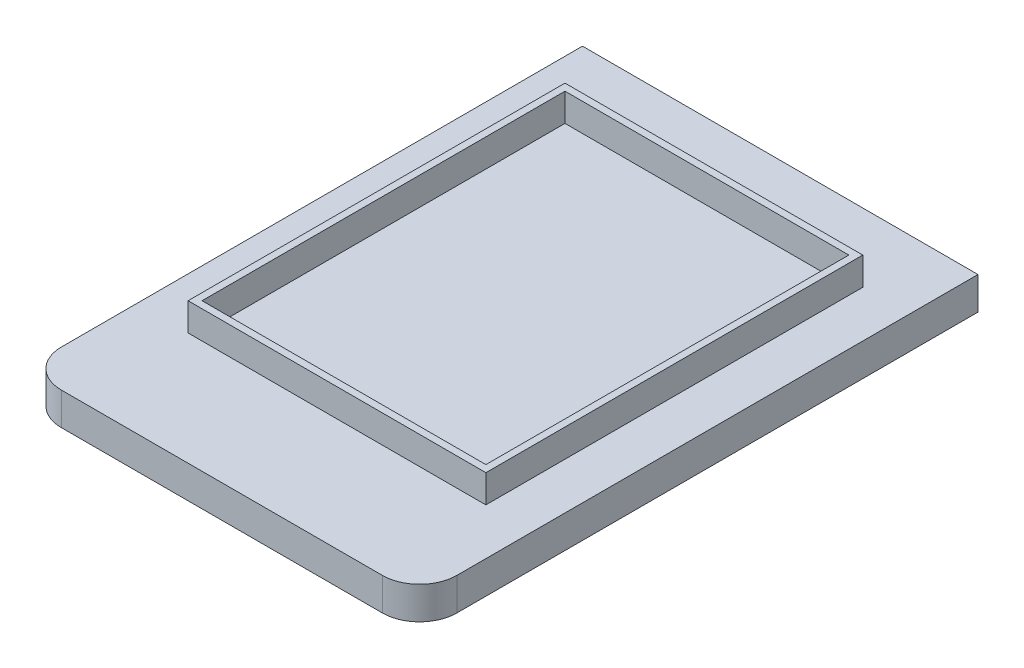
from build123d import *

# Parameters (mm, degrees)
SKETCH1_W           = 85
SKETCH1_H           = 120
BOSS_EXTRUDE1_DEPTH = 7
FILLET1_R           = 8
SKETCH2_W           = 64
SKETCH2_H           = 81
SKETCH2_W_2         = 61
SKETCH2_H_2         = 78
BOSS_EXTRUDE2_DEPTH = 6


with BuildPart() as part:
    # Sketch1 → Boss-Extrude1 (new body)
    with BuildSketch(Plane(origin=(0, 0, 0), x_dir=(1, 0, 0), z_dir=(0, 1, 0))):
        with Locations((42.5, 60)):
            Rectangle(SKETCH1_W, SKETCH1_H)
    extrude(amount=BOSS_EXTRUDE1_DEPTH)

    # Fillet1
    fillet1_edges = [part.edges().sort_by_distance(p)[0] for p in [
        (85, 3.5, 0),
        (0, 3.5, 0),
    ]]
    fillet(fillet1_edges, radius=FILLET1_R)

    # Sketch2 → Boss-Extrude2 (add)
    with BuildSketch(Plane(origin=(0, 7, 0), x_dir=(1, 0, 0), z_dir=(0, 1, 0))):
        with Locations((43, 64.739607224)):
            Rectangle(SKETCH2_W, SKETCH2_H)
        with Locations((43, 64.739607224)):
            Rectangle(SKETCH2_W_2, SKETCH2_H_2, mode=Mode.SUBTRACT)
    extrude(amount=BOSS_EXTRUDE2_DEPTH)


solid = part.part
